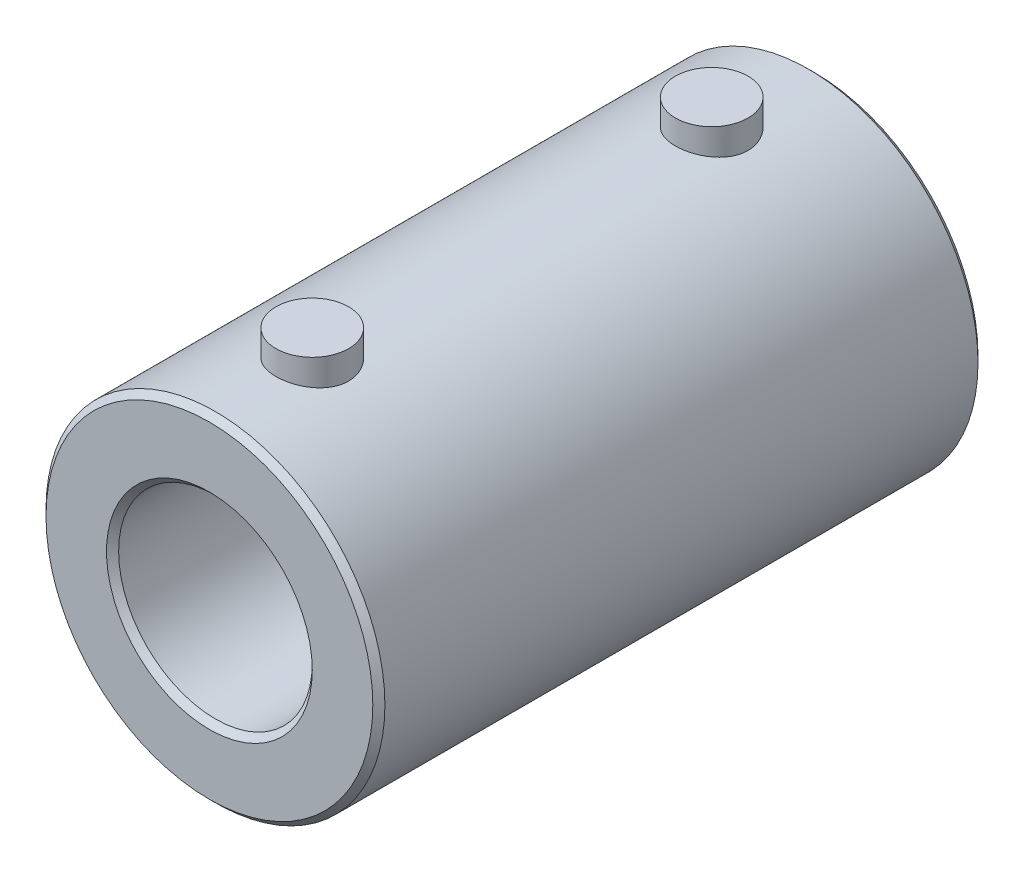
from build123d import *

# Parameters (mm, degrees)
ESQUISSE1_R        = 7
ESQUISSE1_R_2      = 4
BOSS_EXTRU_1_DEPTH = 25
CHANFREIN1_SIZE    = 0.25
BOSS_EXTRU_2_START = 5
ESQUISSE2_R        = 1.5
BOSS_EXTRU_2_DEPTH = 3


with BuildPart() as part:
    # Esquisse1 → Boss.-Extru.1 (new body)
    with BuildSketch(Plane.XY):
        Circle(ESQUISSE1_R)
        Circle(ESQUISSE1_R_2, mode=Mode.SUBTRACT)
    extrude(amount=BOSS_EXTRU_1_DEPTH)

    # Chanfrein1
    chanfrein1_edges = [part.edges().sort_by_distance(p)[0] for p in [
        (-7, 0, 0),
        (-7, 0, 25),
        (-4, 0, 0),
        (-4, 0, 25),
    ]]
    chamfer(chanfrein1_edges, length=CHANFREIN1_SIZE)

    # Esquisse2 → Boss.-Extru.2 (add)
    with BuildSketch(Plane(origin=(0, 0, 0), x_dir=(1, 0, 0), z_dir=(0, 1, 0)).offset(BOSS_EXTRU_2_START)):
        with Locations(Location((0, -4.25, 0), (0, 0, 90))):
            Circle(ESQUISSE2_R)
        with Locations(Location((0, -20.75, 0), (0, 0, 90))):
            Circle(ESQUISSE2_R)
    extrude(amount=BOSS_EXTRU_2_DEPTH)


solid = part.part
